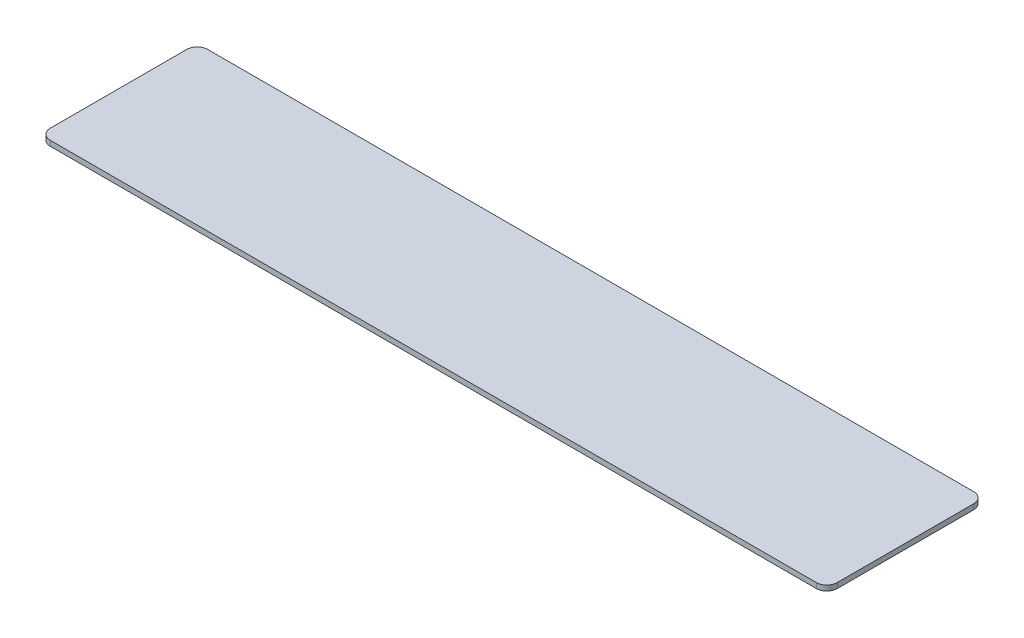
from build123d import *

# Parameters (mm, degrees)
SKETCH1_W           = 190.5
SKETCH1_H           = 38.1
BOSS_EXTRUDE1_DEPTH = 1.27
FILLET1_R           = 2.54


with BuildPart() as part:
    # Sketch1 → Boss-Extrude1 (new body)
    with BuildSketch(Plane(origin=(0, 0, 0), x_dir=(1, 0, 0), z_dir=(0, 1, 0))):
        with Locations((95.25, 19.05)):
            Rectangle(SKETCH1_W, SKETCH1_H)
    extrude(amount=BOSS_EXTRUDE1_DEPTH)

    # Fillet1
    fillet1_edges = [part.edges().sort_by_distance(p)[0] for p in [
        (0, 0.635, -38.1),
        (190.5, 0.635, -38.1),
        (190.5, 0.635, 0),
        (0, 0.635, 0),
    ]]
    fillet(fillet1_edges, radius=FILLET1_R)


solid = part.part
